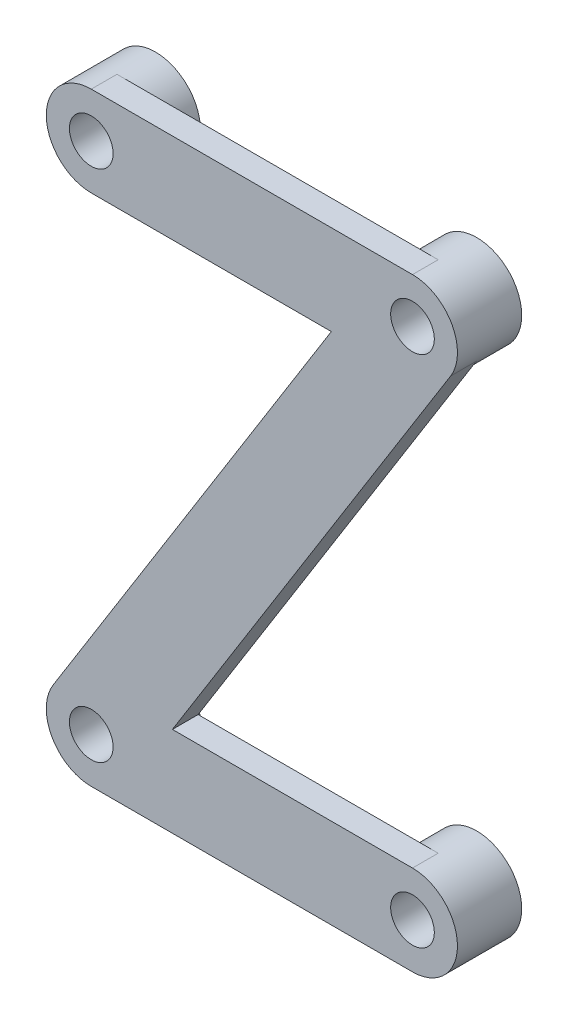
from build123d import *

# Parameters (mm, degrees)
EXTRUDE_945_DEPTH  = 2
SKETCH_1_3_R       = 3.5
SKETCH_1_3_R_2     = 1.7
EXTRUDE_1017_DEPTH = 5


with BuildPart() as part:
    # Эскиз1 → Extrude 945 (new body)
    with BuildSketch(Plane.XY):
        with BuildLine():
            Line((12.5, 23.5), (-12.5, 23.5))
            ThreePointArc((-12.5, 23.5), (-10.025126266, 22.474873734), (-9, 20))
            ThreePointArc((-9, 20), (-10.025126266, 17.525126266), (-12.5, 16.5))
            Line((-12.5, 16.5), (6.185133255, 16.5))
            Line((6.185133255, 16.5), (-15.467994064, -18.14500371))
            ThreePointArc((-15.467994064, -18.14500371), (-11.535111204, -16.635629388), (-9, -20))
            ThreePointArc((-9, -20), (-10.025126266, -22.474873734), (-12.5, -23.5))
            Line((-12.5, -23.5), (12.5, -23.5))
            ThreePointArc((12.5, -23.5), (9, -20), (12.5, -16.5))
            Line((12.5, -16.5), (-6.185133255, -16.5))
            Line((-6.185133255, -16.5), (15.467994064, 18.14500371))
            ThreePointArc((15.467994064, 18.14500371), (9.438751316, 18.303310137), (12.5, 23.5))
        make_face()
    extrude(amount=-EXTRUDE_945_DEPTH)

    # Эскиз1<3> → Extrude 1017 (add)
    # profile 1 of 4: a face of its own
    with BuildSketch(Plane.XY):
        with Locations((-12.5, 20)):
            Circle(SKETCH_1_3_R)
        with Locations((-12.5, 20)):
            Circle(SKETCH_1_3_R_2, mode=Mode.SUBTRACT)
    # profile 2 of 4: a face of its own
    with BuildSketch(Plane.XY):
        with Locations((12.5, 20)):
            Circle(SKETCH_1_3_R)
        with Locations((12.5, 20)):
            Circle(SKETCH_1_3_R_2, mode=Mode.SUBTRACT)
    # profile 3 of 4: a face of its own
    with BuildSketch(Plane.XY):
        with Locations((-12.5, -20)):
            Circle(SKETCH_1_3_R)
        with Locations((-12.5, -20)):
            Circle(SKETCH_1_3_R_2, mode=Mode.SUBTRACT)
    # profile 4 of 4: a face of its own
    with BuildSketch(Plane.XY):
        with Locations((12.5, -20)):
            Circle(SKETCH_1_3_R)
        with Locations((12.5, -20)):
            Circle(SKETCH_1_3_R_2, mode=Mode.SUBTRACT)
    extrude(amount=-EXTRUDE_1017_DEPTH)


solid = part.part
